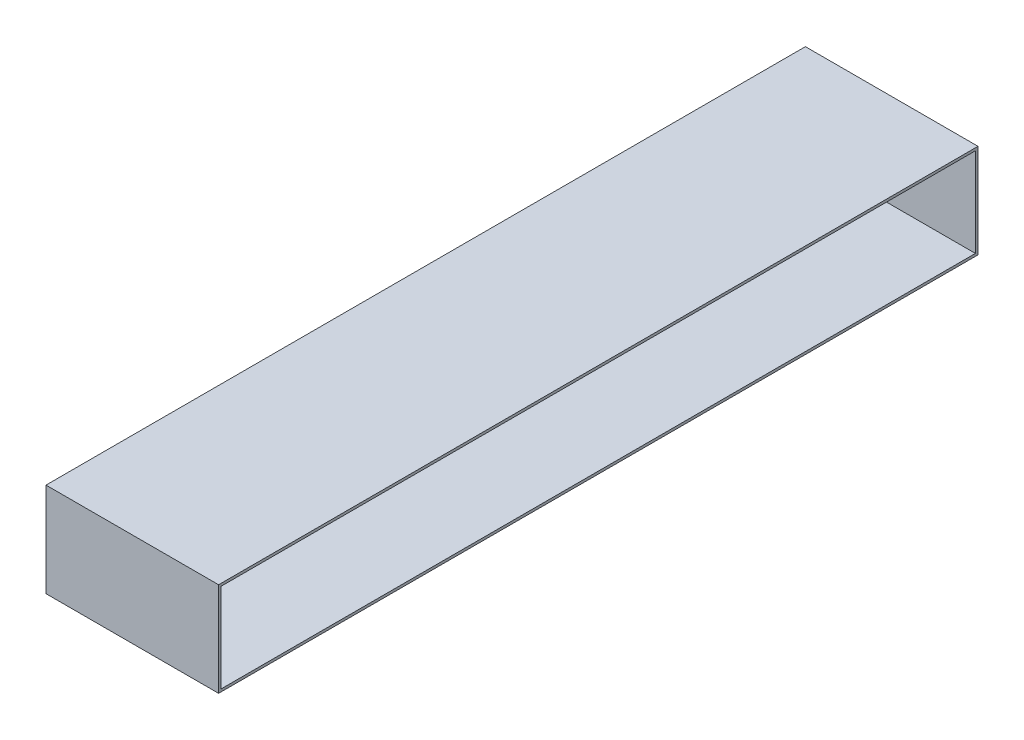
from build123d import *

# Parameters (mm, degrees)
SKETCH3_W           = 880
SKETCH3_H           = 109
SKETCH3_W_2         = 874
SKETCH3_H_2         = 103
BOSS_EXTRUDE2_DEPTH = 200


with BuildPart() as part:
    # Sketch3 → Boss-Extrude2 (new body)
    with BuildSketch(Plane(origin=(0, 0, 0), x_dir=(0, 0, -1), z_dir=(1, 0, 0))):
        with Locations((492.294825051, 60.110635538)):
            Rectangle(SKETCH3_W, SKETCH3_H)
        with Locations((492.294825051, 60.110635538)):
            Rectangle(SKETCH3_W_2, SKETCH3_H_2, mode=Mode.SUBTRACT)
    extrude(amount=BOSS_EXTRUDE2_DEPTH)


solid = part.part
